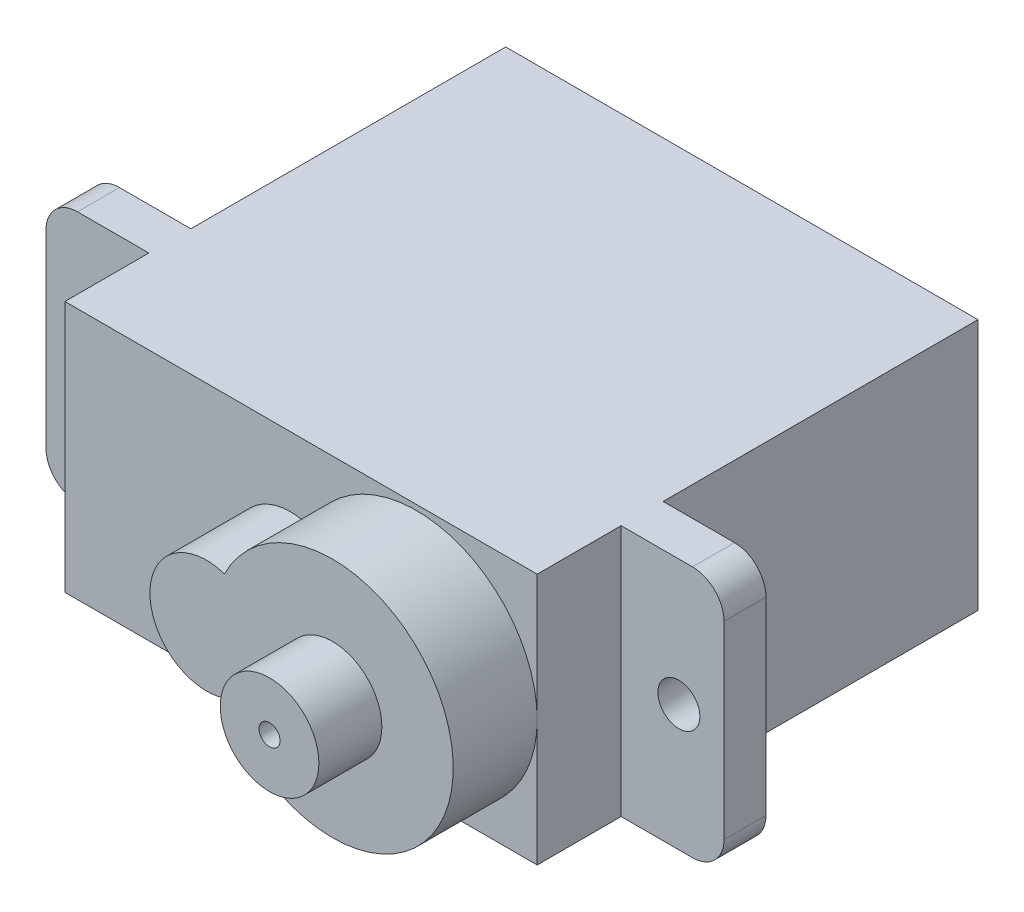
from build123d import *

# Parameters (mm, degrees)
RESSALTO_EXTRUS_O4_DEPTH = 6
ESBO_O8_R                = 5.75
RESSALTO_EXTRUS_O7_DEPTH = 4
ESBO_O9_R                = 2.35
ESBO_O9_R_2              = 0.5
RESSALTO_EXTRUS_O8_DEPTH = 3
ESBO_O10_R               = 2.7
RESSALTO_EXTRUS_O9_DEPTH = 4
ESBO_O12_R               = 1
CORTE_EXTRUS_O1_DEPTH    = 25.203770367
FILETE1_R                = 1.5


with BuildPart() as part:
    # Esboço4 → Ressalto-extrusão4 (new, symmetric)
    with BuildSketch(Plane(origin=(0, 0, 0), x_dir=(1, 0, 0), z_dir=(0, 1, 0))):
        Polygon((-11.25, -10.5), (11.25, -10.5), (11.25, -6.5), (16.15, -6.5), (16.15, -4.5), (11.25, -4.5), (11.25, 10.5), (-11.25, 10.5), (-11.25, -4.5), (-16.15, -4.5), (-16.15, -6.5), (-11.25, -6.5), align=None)
    extrude(amount=RESSALTO_EXTRUS_O4_DEPTH, both=True)

    # Esboço8 → Ressalto-extrusão7 (add)
    with BuildSketch(Plane.XY.offset(10.5)):
        with Locations((5.5, 0)):
            Circle(ESBO_O8_R)
    extrude(amount=RESSALTO_EXTRUS_O7_DEPTH)

    # Esboço9 → Ressalto-extrusão8 (add)
    with BuildSketch(Plane.XY.offset(14.5)):
        with Locations((5.5, 0)):
            Circle(ESBO_O9_R)
        with Locations((5.5, 0)):
            Circle(ESBO_O9_R_2, mode=Mode.SUBTRACT)
    extrude(amount=RESSALTO_EXTRUS_O8_DEPTH)

    # Esboço10 → Ressalto-extrusão9 (add)
    with BuildSketch(Plane.XY.offset(10.5)):
        with Locations((-0.5, 0)):
            Circle(ESBO_O10_R)
    extrude(amount=RESSALTO_EXTRUS_O9_DEPTH)

    # Esboço12 → Corte-extrusão1 (cut, through all)
    with BuildSketch(Plane.XY.offset(6.5)):
        with Locations((-14, 0)):
            Circle(ESBO_O12_R)
        with Locations((14, 0)):
            Circle(ESBO_O12_R)
    extrude(amount=-CORTE_EXTRUS_O1_DEPTH, mode=Mode.SUBTRACT)

    # Filete1
    filete1_edges = [part.edges().sort_by_distance(p)[0] for p in [
        (16.15, -6, 5.5),
        (-16.15, -6, 5.5),
        (-16.15, 6, 5.5),
        (16.15, 6, 5.5),
    ]]
    fillet(filete1_edges, radius=FILETE1_R)


solid = part.part
